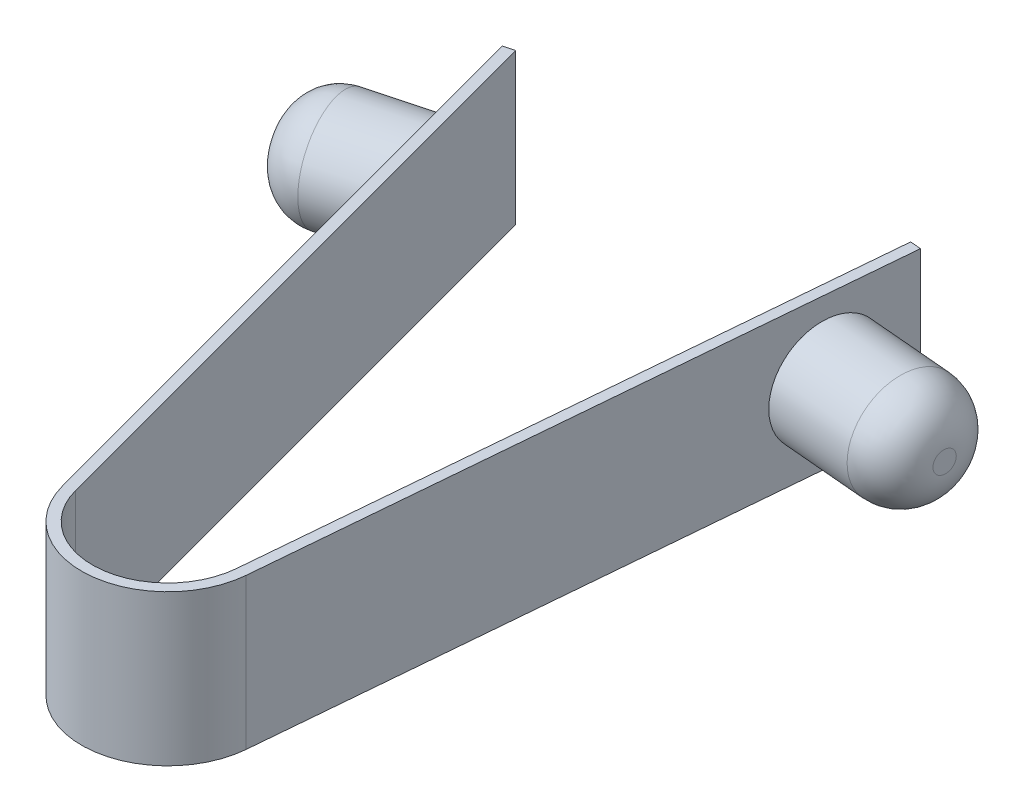
from build123d import *

# Parameters (mm, degrees)
BOSS_EXTRUDE1_DEPTH = 11.1125
SKETCH2_R           = 3.96875
BOSS_EXTRUDE2_DEPTH = 9.525
SKETCH4_R           = 3.96875
BOSS_EXTRUDE3_DEPTH = 9.525
FILLET1_R           = 3.175


with BuildPart() as part:
    # Sketch1 → Boss-Extrude1 (new body)
    with BuildSketch(Plane(origin=(0, 0, 0), x_dir=(1, 0, 0), z_dir=(0, 1, 0))):
        with BuildLine():
            Line((-6.133628997, -1.643500936), (-18.005791029, 42.664010964))
            Line((-18.005791029, 42.664010964), (-17.239087405, 42.869448581))
            Line((-17.239087405, 42.869448581), (-5.366925372, -1.438063319))
            ThreePointArc((-5.366925372, -1.438063319), (0.484259096, -5.535106791), (5.535106791, -0.484259096))
            Line((5.535106791, -0.484259096), (9.532985307, 45.211701443))
            Line((9.532985307, 45.211701443), (10.323714849, 45.142521572))
            Line((10.323714849, 45.142521572), (6.325836333, -0.553438966))
            ThreePointArc((6.325836333, -0.553438966), (0.553438966, -6.325836333), (-6.133628997, -1.643500936))
        make_face()
    extrude(amount=BOSS_EXTRUDE1_DEPTH)

    # Sketch2 → Boss-Extrude2 (add)
    with BuildSketch(Plane(origin=(6.325836333, 0, 0.553438966), x_dir=(0.08715574274765789, 0, -0.9961946980917457), z_dir=(0.9961946980917457, 0, 0.08715574274765789))):
        with Locations(Location((39.520511684, 5.55625, 0), (0, 0, 180))):
            Circle(SKETCH2_R)
    extrude(amount=BOSS_EXTRUDE2_DEPTH)

    # Sketch4 → Boss-Extrude3 (add)
    with BuildSketch(Plane(origin=(-6.133628997, 0, 1.643500936), x_dir=(0.2588190451025218, 0, 0.9659258262890681), z_dir=(-0.9659258262890681, 0, 0.2588190451025218))):
        with Locations((-39.520511684, 5.55625)):
            Circle(SKETCH4_R)
    extrude(amount=BOSS_EXTRUDE3_DEPTH)

    # Fillet1
    fillet1_edges = [part.edges().sort_by_distance(p)[0] for p in [
        (19.604929736, 5.55625, -41.940174498),
        (-26.589921674, 5.55625, -37.898648686),
    ]]
    fillet(fillet1_edges, radius=FILLET1_R)


solid = part.part
